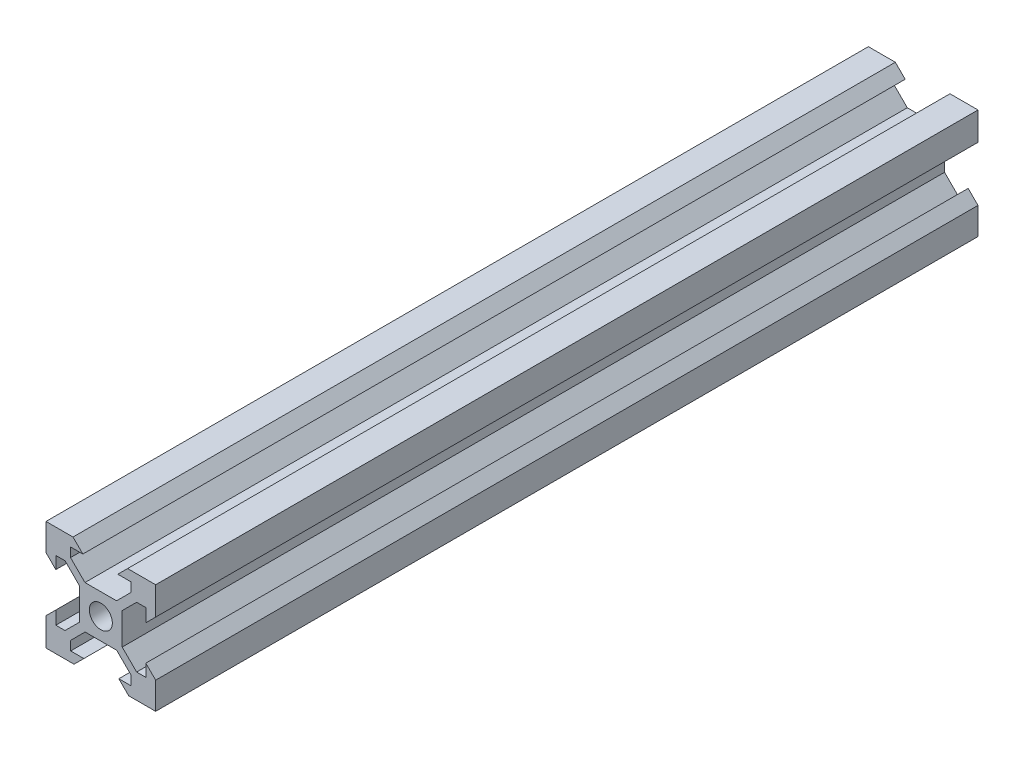
from build123d import *

# Parameters (mm, degrees)
SKETCH1_R           = 2.1
BOSS_EXTRUDE1_DEPTH = 150


with BuildPart() as part:
    # Sketch1 (on Front Plane) → Boss-Extrude1 (new body)
    with BuildSketch(Plane.XY):
        Polygon((-5.074586208, 10), (-3.28215401, 8.207567802), (-5.525872647, 8.207567802), (-5.525872647, 6.527957213), (-2.897129144, 3.89921371), (2.868055105, 3.89921371), (5.496798608, 6.527957213), (5.496798608, 8.207567802), (3.093698324, 8.207567802), (4.886130522, 10), (10, 10), (10, 4.886130522), (8.207567802, 3.093698324), (8.207567802, 5.496798608), (6.527957213, 5.496798608), (3.89921371, 2.868055105), (3.89921371, -2.897129144), (6.527957213, -5.525872647), (8.207567802, -5.525872647), (8.207567802, -3.28215401), (10, -5.074586208), (10, -10), (5.074586208, -10), (3.28215401, -8.207567802), (5.525872647, -8.207567802), (5.525872647, -6.527957213), (2.897129144, -3.89921371), (-2.868055105, -3.89921371), (-5.496798608, -6.527957213), (-5.496798608, -8.207567802), (-3.093698324, -8.207567802), (-4.886130522, -10), (-10, -10), (-10, -4.886130522), (-8.207567802, -3.093698324), (-8.207567802, -5.496798608), (-6.527957213, -5.496798608), (-3.89921371, -2.868055105), (-3.89921371, 2.897129144), (-6.527957213, 5.525872647), (-8.207567802, 5.525872647), (-8.207567802, 3.28215401), (-10, 5.074586208), (-10, 10), align=None)
        Circle(SKETCH1_R, mode=Mode.SUBTRACT)
    extrude(amount=BOSS_EXTRUDE1_DEPTH)


solid = part.part
